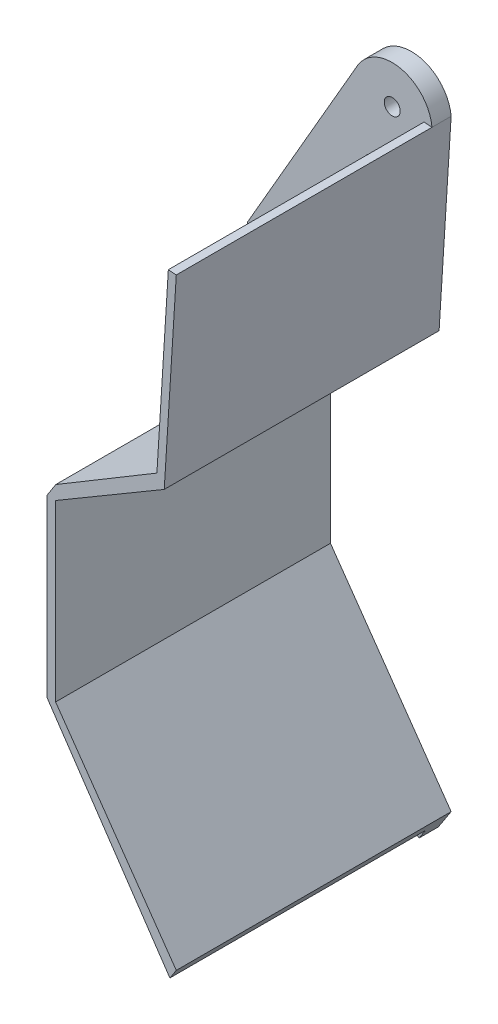
from build123d import *

# Parameters (mm, degrees)
EXTRUDE_4_DEPTH     = 3
EXTRUDE_6_DEPTH     = 43
EXTRUDE_7_DEPTH     = 40
EXTRUDE_8_DEPTH     = 40
SKETCH_14_R         = 1.25
CUT_EXTRUDE_3_DEPTH = 10


with BuildPart() as part:
    # 草图1 → 凸台-拉伸4 (new body)
    with BuildSketch(Plane.XY):
        with BuildLine():
            ThreePointArc((11.999755772, 64.190702015), (7.19287537, 69.699227744), (0.441332655, 66.894477154))
            Line((0.441332655, 66.894477154), (-16.87917542, 36.894477154))
            Line((-16.87917542, 36.894477154), (-16.87917542, -3.105522846))
            Line((-16.87917542, -3.105522846), (-5.332170037, -23.105522846))
            Line((-5.332170037, -23.105522846), (9.992741519, -33.105522846))
            Line((9.992741519, -33.105522846), (11.999755772, -30.029791253))
            Line((11.999755772, -30.029791253), (-6.87917542, -3.105522846))
            Line((-6.87917542, -3.105522846), (-6.87917542, 14.190702015))
            Line((-6.87917542, 14.190702015), (-6.87917542, 24.190702015))
            Line((-6.87917542, 24.190702015), (10.114332844, 34.190702015))
            Line((10.114332844, 34.190702015), (11.999755772, 64.190702015))
        make_face()
    extrude(amount=EXTRUDE_4_DEPTH)

    # 草图6 → 凸台-拉伸6 (add)
    with BuildSketch(Plane(origin=(0, 0, 0), x_dir=(-1, 0, 0), z_dir=(0, 0, -1))):
        Polygon((6.87917542, 24.190702015), (8.248400541, 24.190702015), (8.248400541, -3.145484966), (-10.996248645, -31.567657049), (-11.999755772, -30.029791253), (6.87917542, -3.105522846), align=None)
    extrude(amount=-EXTRUDE_6_DEPTH)

    # 草图9 → 凸台-拉伸7 (add)
    with BuildSketch(Plane.XY.offset(3)):
        Polygon((-8.248400541, 24.190702015), (-6.858844556, 26.362086453), (8.966526684, 35.828548473), (10.114332844, 34.190702015), (-6.87917542, 24.190702015), align=None)
    extrude(amount=EXTRUDE_7_DEPTH)

    # 草图11 → 凸台-拉伸8 (add)
    with BuildSketch(Plane.XY.offset(3)):
        Polygon((8.966526684, 35.828548473), (10.756094136, 64.281113509), (11.999755772, 64.190702015), (10.114332844, 34.190702015), align=None)
    extrude(amount=EXTRUDE_8_DEPTH)

    # 草图14 → 切除-拉伸3 (cut)
    with BuildSketch(Plane(origin=(0, 0, 0), x_dir=(-1, 0, 0), z_dir=(0, 0, -1))):
        with Locations((-2.591697764, 54.404600603)):
            Circle(SKETCH_14_R)
        with Locations((-5.784422652, 63.881230161)):
            Circle(SKETCH_14_R)
    extrude(amount=-CUT_EXTRUDE_3_DEPTH, mode=Mode.SUBTRACT)


solid = part.part
